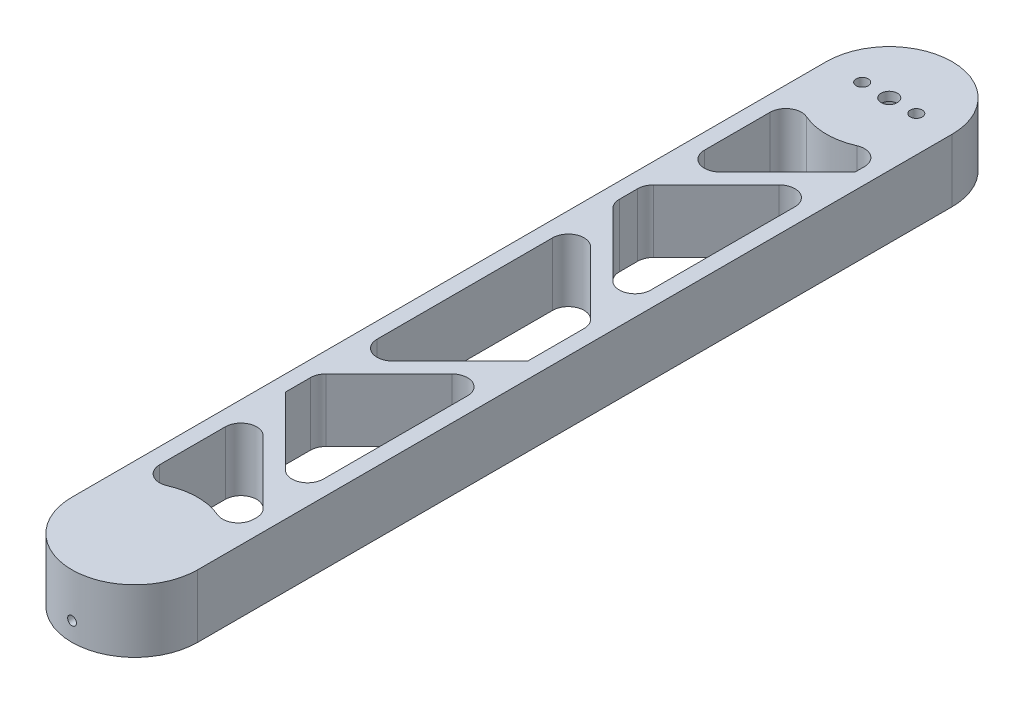
from build123d import *

# Parameters (mm, degrees)
SKETCH1_R           = 12.7
BOSS_EXTRUDE1_DEPTH = 12.7
SKETCH2_R           = 1.6256
CUT_EXTRUDE1_DEPTH  = 9.525
SKETCH3_R           = 9.525
CUT_EXTRUDE2_DEPTH  = 2.54
BOSS_EXTRUDE2_START = -12.7
BOSS_EXTRUDE2_DEPTH = 12.7
SKETCH10_R          = 1.651
CUT_EXTRUDE4_DEPTH  = 12.7
SKETCH11_R          = 9.525
CUT_EXTRUDE5_DEPTH  = 5.18668
CUT_EXTRUDE6_DEPTH  = 12.7
FILLET1_R           = 3.175
SKETCH16_R          = 8.255
CUT_EXTRUDE8_DEPTH  = 3.175
SKETCH17_R          = 1.2192
CUT_EXTRUDE9_DEPTH  = 4.33832
SKETCH18_R          = 3.81
CUT_EXTRUDE10_DEPTH = 2.54


with BuildPart() as part:
    # Sketch1 → Boss-Extrude1 (new body)
    with BuildSketch(Plane(origin=(0, 0, 0), x_dir=(1, 0, 0), z_dir=(0, 1, 0))):
        with Locations(Location((0, 0, 0), (0, 0, 270))):
            Circle(SKETCH1_R)
    extrude(amount=BOSS_EXTRUDE1_DEPTH)

    # Sketch2 → Cut-Extrude1 (cut)
    with BuildSketch(Plane.XZ):
        with Locations(Location((0, 0, 0), (0, 0, 270))):
            Circle(SKETCH2_R)
    extrude(amount=-CUT_EXTRUDE1_DEPTH, mode=Mode.SUBTRACT)

    # Sketch3 → Cut-Extrude2 (cut)
    with BuildSketch(Plane.XZ):
        with Locations(Location((0, 0, 0), (0, 0, 270))):
            Circle(SKETCH3_R)
    extrude(amount=-CUT_EXTRUDE2_DEPTH, mode=Mode.SUBTRACT)

    # Sketch5 → #2-56 Tapped Hole1 (revolve, cut)
    with BuildSketch(Plane(origin=(0, 3.81, 0), x_dir=(0, 1, 0), z_dir=(1, 0, 0))):
        Polygon((0, 0), (0, 13.74216509), (0.889, 13.208), (0.889, 0), align=None)
    revolve(axis=Axis((0, 3.81, -6.35), (0, 0, 1)), mode=Mode.SUBTRACT)

    # Sketch7 → Boss-Extrude2 (add)
    with BuildSketch(Plane(origin=(0, 12.7, 0), x_dir=(1, 0, 0), z_dir=(0, 1, 0)).offset(BOSS_EXTRUDE2_START)):
        with BuildLine():
            Line((-12.7, 152.4), (-12.7, 0))
            ThreePointArc((-12.7, 0), (0, 12.7), (12.7, 0))
            Line((12.7, 0), (12.7, 152.4))
            ThreePointArc((12.7, 152.4), (0, 165.1), (-12.7, 152.4))
        make_face()
    extrude(amount=BOSS_EXTRUDE2_DEPTH)

    # Sketch10 → Cut-Extrude4 (cut)
    with BuildSketch(Plane.XZ):
        with Locations(Location((0, -152.4, 0), (0, 0, 270))):
            Circle(SKETCH10_R)
    extrude(amount=-CUT_EXTRUDE4_DEPTH, mode=Mode.SUBTRACT)

    # Sketch11 → Cut-Extrude5 (cut)
    with BuildSketch(Plane.XZ):
        with Locations(Location((0, -152.4, 0), (0, 0, 270))):
            Circle(SKETCH11_R)
    extrude(amount=-CUT_EXTRUDE5_DEPTH, mode=Mode.SUBTRACT)

    # Sketch15 → Cut-Extrude6 (cut)
    with BuildSketch(Plane.XZ):
        with BuildLine():
            Line((-9.525, -35.469743879), (9.525, -16.419743879))
            Line((9.525, -16.419743879), (9.525, -8.400260413))
            ThreePointArc((9.525, -8.400260413), (0, -12.7), (-9.525, -8.400260413))
            Line((-9.525, -8.400260413), (-9.525, -35.469743879))
        make_face()
        Polygon((-9.525, -46.309871939), (9.525, -65.359871939), (9.525, -20.909871939), (-9.525, -39.959871939), align=None)
        Polygon((-9.525, -76.2), (9.525, -76.2), (9.525, -69.85), (-9.525, -50.8), align=None)
        Polygon((9.525, -82.55), (9.525, -76.2), (-9.525, -76.2), (-9.525, -101.6), align=None)
        Polygon((9.525, -131.490128061), (9.525, -87.040128061), (-9.525, -106.090128061), (-9.525, -112.440128061), align=None)
        with BuildLine():
            Line((9.525, -143.999739587), (9.525, -135.980256121))
            Line((9.525, -135.980256121), (-9.525, -116.930256121))
            Line((-9.525, -116.930256121), (-9.525, -143.999739587))
            ThreePointArc((-9.525, -143.999739587), (0, -139.7), (9.525, -143.999739587))
        make_face()
    extrude(amount=-CUT_EXTRUDE6_DEPTH, mode=Mode.SUBTRACT)

    # Fillet1
    fillet1_edges = [part.edges().sort_by_distance(p)[0] for p in [
        (9.525, 6.35, -143.999739587),
        (-9.525, 6.35, -143.999739587),
        (-9.525, 6.35, -116.930256121),
        (-9.525, 6.35, -35.469743879),
        (9.525, 6.35, -16.419743879),
        (9.525, 6.35, -8.400260413),
        (-9.525, 6.35, -8.400260413),
        (-9.525, 6.35, -46.309871939),
        (9.525, 6.35, -65.359871939),
        (9.525, 6.35, -20.909871939),
        (-9.525, 6.35, -101.6),
        (-9.525, 6.35, -50.8),
        (9.525, 6.35, -82.55),
        (9.525, 6.35, -131.490128061),
        (9.525, 6.35, -87.040128061),
        (-9.525, 6.35, -106.090128061),
        (-9.525, 6.35, -112.440128061),
    ]]
    fillet(fillet1_edges, radius=FILLET1_R)

    # Sketch16 → Cut-Extrude8 (cut)
    with BuildSketch(Plane.XZ.offset(-5.18668)):
        with Locations(Location((0, -152.4, 0), (0, 0, 270))):
            Circle(SKETCH16_R)
    extrude(amount=-CUT_EXTRUDE8_DEPTH, mode=Mode.SUBTRACT)

    # Sketch17 → Cut-Extrude9 (cut)
    with BuildSketch(Plane.XZ.offset(-8.36168)):
        with Locations(Location((-5.4599967, -152.4, 0), (0, 0, 270))):
            Circle(SKETCH17_R)
        with Locations(Location((5.4599967, -152.4, 0), (0, 0, 270))):
            Circle(SKETCH17_R)
    extrude(amount=-CUT_EXTRUDE9_DEPTH, mode=Mode.SUBTRACT)

    # Sketch18 → Cut-Extrude10 (cut)
    with BuildSketch(Plane.XZ.offset(-8.36168)):
        with Locations(Location((0, -152.4, 0), (0, 0, 270))):
            Circle(SKETCH18_R)
    extrude(amount=-CUT_EXTRUDE10_DEPTH, mode=Mode.SUBTRACT)


solid = part.part
